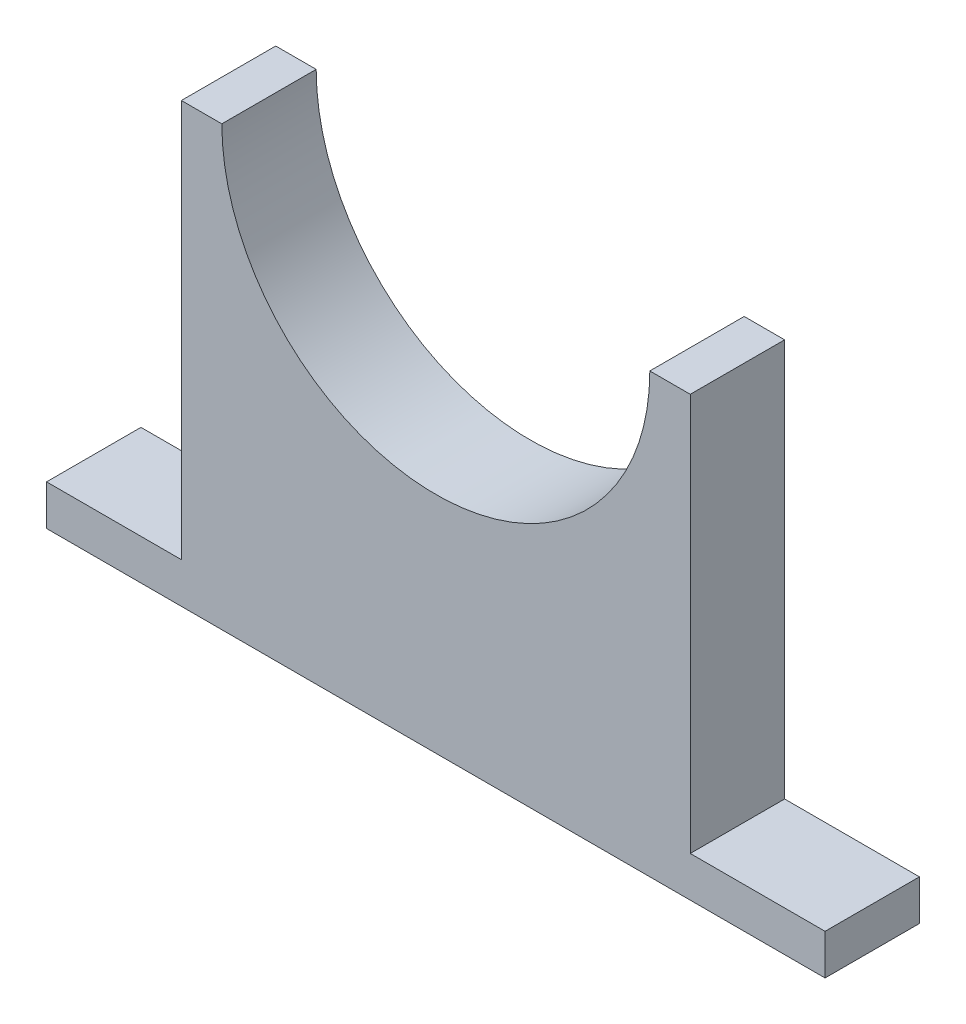
from build123d import *

# Parameters (mm, degrees)
BOSS_EXTRUDE1_DEPTH = 7


with BuildPart() as part:
    # Sketch1 → Boss-Extrude1 (new body)
    with BuildSketch(Plane.XY):
        with BuildLine():
            Line((-15.875, 0), (-18.875, 0))
            Line((-18.875, 0), (-18.875, -29.5))
            Line((-18.875, -29.5), (-28.875, -29.5))
            Line((-28.875, -29.5), (-28.875, -32.5))
            Line((-28.875, -32.5), (28.875, -32.5))
            Line((28.875, -32.5), (28.875, -29.5))
            Line((28.875, -29.5), (18.875, -29.5))
            Line((18.875, -29.5), (18.875, 0))
            Line((18.875, 0), (15.875, 0))
            ThreePointArc((15.875, 0), (0, -15.875), (-15.875, 0))
        make_face()
    extrude(amount=BOSS_EXTRUDE1_DEPTH)


solid = part.part
